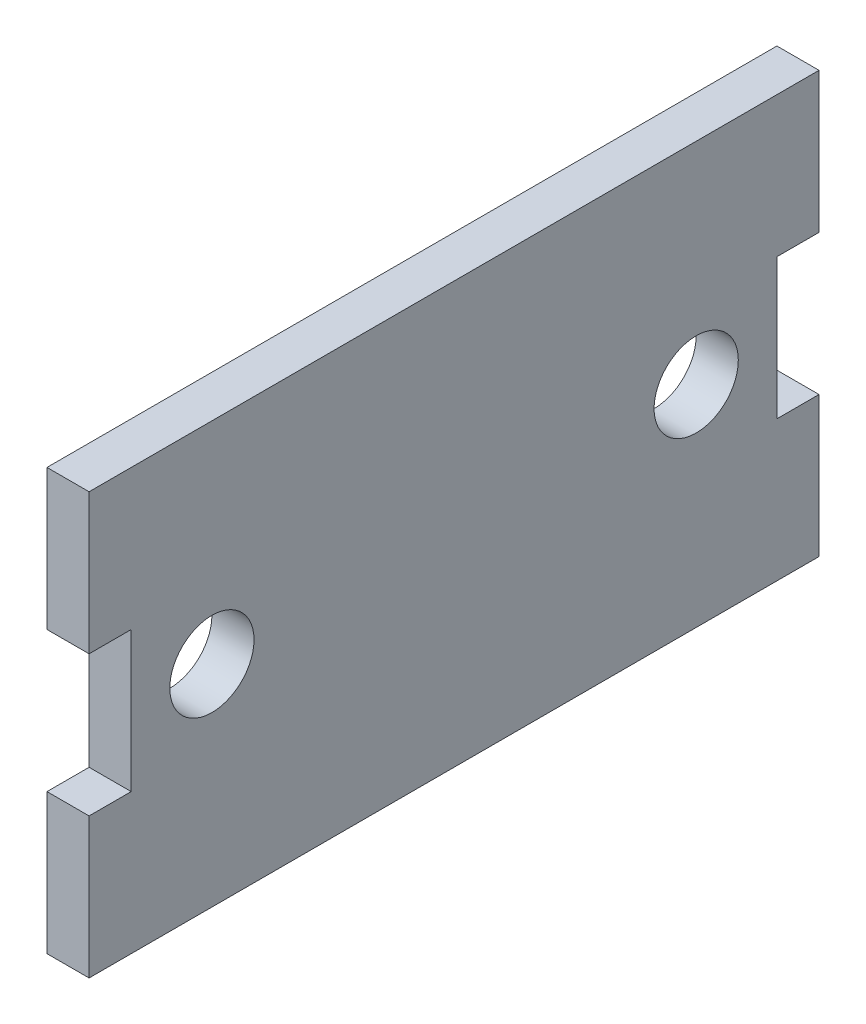
from build123d import *

# Parameters (mm, degrees)
BOSS_EXTRUDE1_DEPTH = 1.5
SKETCH2_R           = 1.5
CUT_EXTRUDE1_DEPTH  = 31.054117854


with BuildPart() as part:
    # Sketch1 → Boss-Extrude1 (new body)
    with BuildSketch(Plane.YZ):
        Polygon((0, 0), (0, 26), (5, 26), (5, 24.5), (10, 24.5), (10, 26), (15, 26), (15, 0), (10, 0), (10, 1.5), (5, 1.5), (5, 0), align=None)
    extrude(amount=BOSS_EXTRUDE1_DEPTH)

    # Sketch2 → Cut-Extrude1 (cut, through all)
    with BuildSketch(Plane.YZ.offset(1.5)):
        with Locations(Location((7.5, 21.625, 0), (0, 0, 270))):
            Circle(SKETCH2_R)
        with Locations(Location((7.5, 4.375, 0), (0, 0, 270))):
            Circle(SKETCH2_R)
    extrude(amount=-CUT_EXTRUDE1_DEPTH, mode=Mode.SUBTRACT)


solid = part.part
